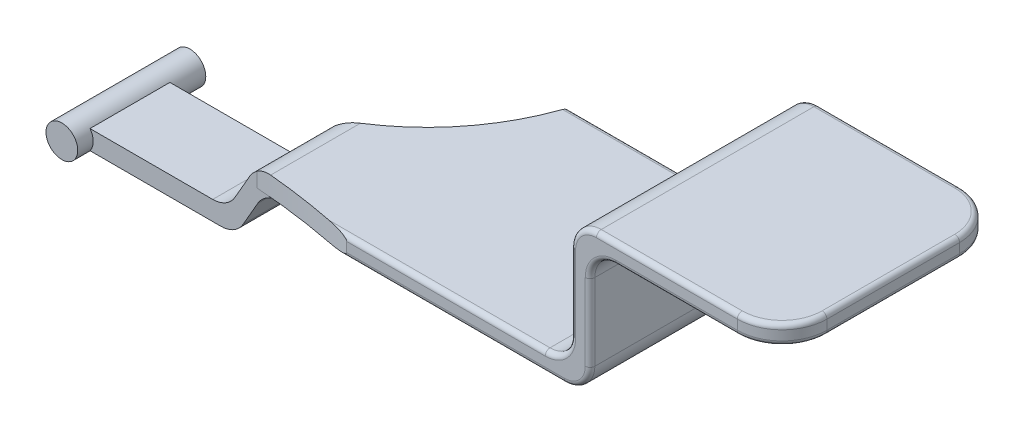
from build123d import *

# Parameters (mm, degrees)
SKETCH2_R            = 2.48
BOSS_EXTRUDE1_DEPTH  = 20
SKETCH3_W            = 24.73
SKETCH3_H            = 12.48
BOSS_EXTRUDE3_DEPTH  = 1.5
BOSS_EXTRUDE7_DEPTH  = 12.48
BOSS_EXTRUDE9_DEPTH  = 3
SKETCH9_W            = 10
SKETCH9_H            = 3
BOSS_EXTRUDE10_DEPTH = 34.71
SKETCH10_W           = 3
SKETCH10_H           = 23
BOSS_EXTRUDE11_DEPTH = 34.71
SKETCH11_W           = 34.71
SKETCH11_H           = 3
BOSS_EXTRUDE12_DEPTH = 30
FILLET1_R            = 4
FILLET3_R            = 7
FILLET4_R            = 0.75


with BuildPart() as part:
    # Sketch2 → Boss-Extrude1 (new body)
    with BuildSketch(Plane.XY):
        Circle(SKETCH2_R)
    extrude(amount=BOSS_EXTRUDE1_DEPTH)

    # Sketch3 → Boss-Extrude3 (add, symmetric)
    with BuildSketch(Plane(origin=(0, 0, 0), x_dir=(1, 0, 0), z_dir=(0, 1, 0))):
        with Locations((12.365, -11.34)):
            Rectangle(SKETCH3_W, SKETCH3_H)
    extrude(amount=BOSS_EXTRUDE3_DEPTH, both=True)

    # Sketch7 → Boss-Extrude7 (add)
    with BuildSketch(Plane.XY.offset(5.1)):
        Polygon((21.73, -1.5), (24.73, -1.5), (31.062035578, 9.5), (28.062035578, 9.5), align=None)
    extrude(amount=BOSS_EXTRUDE7_DEPTH)

    # Sketch8 → Boss-Extrude9 (add)
    with BuildSketch(Plane(origin=(0, 9.5, 0), x_dir=(1, 0, 0), z_dir=(0, 1, 0))):
        with BuildLine():
            Line((72.552035578, -20.06), (44.552035578, -20.06))
            ThreePointArc((44.552035578, -20.06), (36.356523667, -18.490944118), (28.062035578, -17.58))
            Line((28.062035578, -17.58), (28.062035578, -5.1))
            ThreePointArc((28.062035578, -5.1), (38.220194009, 3.177633796), (44.552035578, 14.65))
            Line((44.552035578, 14.65), (72.552035578, 14.65))
            Line((72.552035578, 14.65), (72.552035578, -20.06))
        make_face()
    extrude(amount=-BOSS_EXTRUDE9_DEPTH)

    # Sketch9 → Boss-Extrude10 (add)
    with BuildSketch(Plane.XY.offset(20.06)):
        with Locations((77.552035578, 8)):
            Rectangle(SKETCH9_W, SKETCH9_H)
    extrude(amount=-BOSS_EXTRUDE10_DEPTH)

    # Sketch10 → Boss-Extrude11 (add)
    with BuildSketch(Plane.XY.offset(20.06)):
        with Locations((81.052035578, 18)):
            Rectangle(SKETCH10_W, SKETCH10_H)
    extrude(amount=-BOSS_EXTRUDE11_DEPTH)

    # Sketch11 → Boss-Extrude12 (add)
    with BuildSketch(Plane(origin=(82.552035578, 0, 0), x_dir=(0, 0, -1), z_dir=(1, 0, 0))):
        with Locations((-2.705, 28)):
            Rectangle(SKETCH11_W, SKETCH11_H)
    extrude(amount=BOSS_EXTRUDE12_DEPTH)

    # Fillet1
    fillet1_edges = [part.edges().sort_by_distance(p)[0] for p in [
        (24.73, -1.5, 11.34),
        (82.552035578, 26.5, 2.705),
        (23.456918794, 1.5, 11.34),
        (28.062035578, 9.5, 11.34),
        (29.335116784, 6.5, 11.34),
        (82.552035578, 6.5, 2.705),
        (79.552035578, 9.5, 2.705),
        (79.552035578, 29.5, 2.705),
    ]]
    fillet(fillet1_edges, radius=FILLET1_R)

    # Fillet3
    fillet3_edges = [part.edges().sort_by_distance(p)[0] for p in [
        (112.552035578, 28, 20.06),
        (112.552035578, 28, -14.65),
    ]]
    fillet(fillet3_edges, radius=FILLET3_R)

    # Fillet4
    fillet4_edges = [part.edges().sort_by_distance(p)[0] for p in [
        (60.052035578, 9.5, -14.65),
        (61.552035578, 6.5, -14.65),
        (82.552035578, 16.5, 20.06),
        (79.552035578, 19.5, 20.06),
        (80.723608453, 28.328427125, 20.06),
        (81.380462702, 7.671572875, 20.06),
        (82.552035578, 16.5, -14.65),
        (79.552035578, 19.5, -14.65),
        (80.723608453, 28.328427125, -14.65),
        (81.380462702, 7.671572875, -14.65),
        (78.380462702, 10.671572875, -14.65),
        (78.380462702, 10.671572875, 20.06),
        (83.723608453, 25.328427125, -14.65),
        (83.723608453, 25.328427125, 20.06),
        (112.552035578, 26.5, 2.705),
        (112.552035578, 29.5, 2.705),
        (96.052035578, 26.5, 20.06),
        (96.052035578, 26.5, -14.65),
        (110.501783046, 26.5, -12.599747468),
        (110.501783046, 26.5, 18.009747468),
        (94.552035578, 29.5, 20.06),
        (94.552035578, 29.5, -14.65),
        (110.501783046, 29.5, -12.599747468),
        (110.501783046, 29.5, 18.009747468),
        (60.052035578, 9.5, 20.06),
        (44.552035578, 8, -14.65),
        (61.552035578, 6.5, 20.06),
    ]]
    fillet(fillet4_edges, radius=FILLET4_R)


with BuildPart() as body_2:
    # Mirror5: mirrored copy
    add(part.part.mirror(Plane(origin=(119.85106591, 0, 0), x_dir=(0, 0, 1), z_dir=(1, 0, 0))))


with BuildPart() as body_2_2:
    # Mirror6: mirrored copy
    add(body_2.part.mirror(Plane(origin=(119.85106591, 0, 0), x_dir=(0, 0, 1), z_dir=(1, 0, 0))))


solid = body_2_2.part
